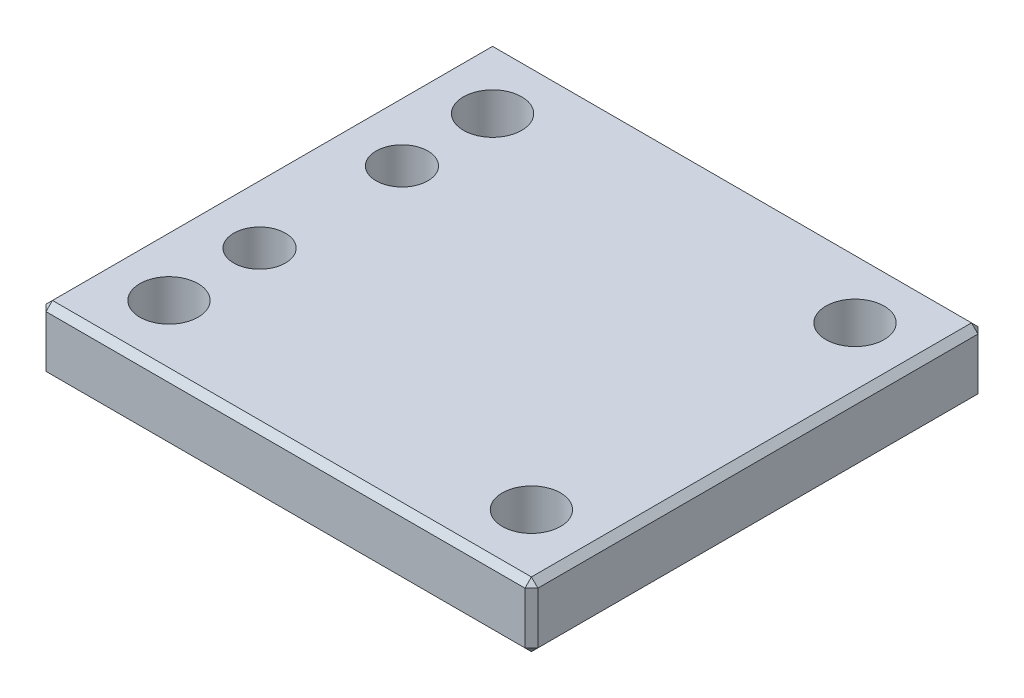
from build123d import *

# Parameters (mm, degrees)
SKETCH_1_W          = 38
SKETCH_1_H          = 35
EXTRUDE_1_DEPTH     = 5
CHAMFER_1_SIZE      = 0.5
SKETCH_2_R          = 2.25
SKETCH_2_R_2        = 2
CUT_EXTRUDE_1_DEPTH = 52.903757089


with BuildPart() as part:
    # 草图1 → 凸台-拉伸1 (new body)
    with BuildSketch(Plane(origin=(0, 0, 0), x_dir=(1, 0, 0), z_dir=(0, 1, 0))):
        with Locations((19, 17.5)):
            Rectangle(SKETCH_1_W, SKETCH_1_H)
    extrude(amount=EXTRUDE_1_DEPTH)

    # 倒角1
    chamfer_1_edges = [part.edges().sort_by_distance(p)[0] for p in [
        (38, 5, -17.5),
        (19, 5, -35),
        (0, 5, -17.5),
        (19, 0, -35),
        (38, 0, -17.5),
        (19, 0, 0),
        (0, 0, -17.5),
        (19, 5, 0),
        (0, 2.5, -35),
        (38, 2.5, -35),
        (38, 2.5, 0),
        (0, 2.5, 0),
    ]]
    chamfer(chamfer_1_edges, length=CHAMFER_1_SIZE)

    # 草图2 → 切除-拉伸1 (cut, through all)
    with BuildSketch(Plane.XZ):
        with Locations(Location((5, -5, 0), (0, 0, 270))):
            Circle(SKETCH_2_R)
        with Locations(Location((5, -30, 0), (0, 0, 270))):
            Circle(SKETCH_2_R)
        with Locations(Location((33, -30, 0), (0, 0, 270))):
            Circle(SKETCH_2_R)
        with Locations(Location((33, -5, 0), (0, 0, 270))):
            Circle(SKETCH_2_R)
        with Locations(Location((5, -12, 0), (0, 0, 270))):
            Circle(SKETCH_2_R_2)
        with Locations(Location((5, -23, 0), (0, 0, 270))):
            Circle(SKETCH_2_R_2)
    extrude(amount=-CUT_EXTRUDE_1_DEPTH, mode=Mode.SUBTRACT)


solid = part.part
